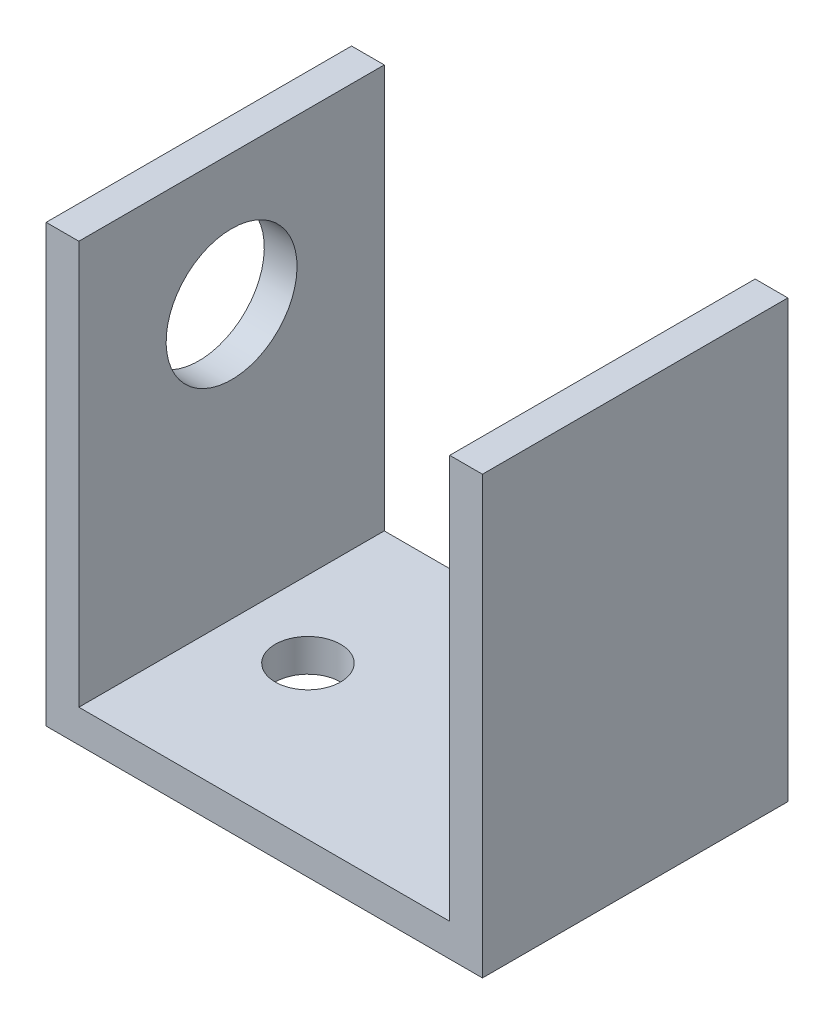
from build123d import *

# Parameters (mm, degrees)
EXTRUSION1_DEPTH = 14
ESQUISSE2_R      = 1.5
EXTRUSION2_DEPTH = 39.83919024
ESQUISSE4_R      = 3
EXTRUSION3_DEPTH = 29.536760028


with BuildPart() as part:
    # Esquisse1 → Extrusion1 (new body)
    with BuildSketch(Plane.XY):
        Polygon((-31.14855853, 3.383843017), (-29.64855853, 3.383843017), (-29.64855853, -15.116156983), (-12.64855853, -15.116156983), (-12.64855853, 3.383843017), (-11.14855853, 3.383843017), (-11.14855853, -16.616156983), (-31.14855853, -16.616156983), align=None)
    extrude(amount=EXTRUSION1_DEPTH)

    # Esquisse2 → Extrusion2 (cut, through all)
    with BuildSketch(Plane(origin=(0, -15.116156983, 0), x_dir=(-1, 0, 0), z_dir=(0, 1, 0))):
        with Locations((26.14855853, 7)):
            Circle(ESQUISSE2_R)
        with Locations((16.14855853, 7)):
            Circle(ESQUISSE2_R)
    extrude(amount=-EXTRUSION2_DEPTH, mode=Mode.SUBTRACT)

    # Esquisse4 → Extrusion3 (cut, through all)
    with BuildSketch(Plane(origin=(-29.64855853, 0, 0), x_dir=(0, 0, -1), z_dir=(1, 0, 0))):
        with Locations(Location((-7, -2.616156983, 0), (0, 0, 90))):
            Circle(ESQUISSE4_R)
    extrude(amount=-EXTRUSION3_DEPTH, mode=Mode.SUBTRACT)


solid = part.part
